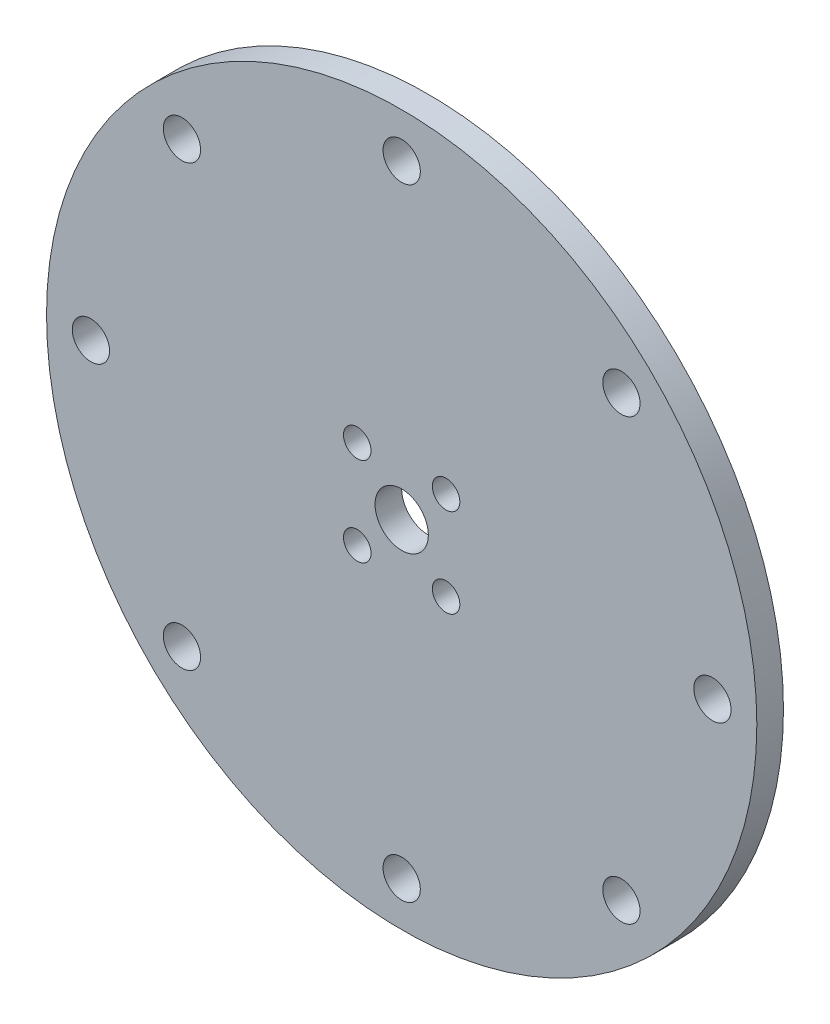
from build123d import *

# Parameters (mm, degrees)
SKETCH_3_R           = 48
EXTRUDE_2_DEPTH      = 3
SKETCH_4_R           = 3
CUT_EXTRUDE_1_DEPTH  = 3
EXTRUDE_3_DEPTH      = 35
SKETCH_6_R           = 3
SKETCH_6_R_2         = 1.5
CUT_EXTRUDE_2_DEPTH  = 35
SKETCH_7_R           = 1.55
CUT_EXTRUDE_5_DEPTH  = 35
CUT_EXTRUDE_START    = -35
SKETCH_9_R           = 48
SKETCH_9_R_2         = 40
CUT_EXTRUDE_6_DEPTH  = 35
SKETCH_10_R          = 40
CUT_EXTRUDE_7_DEPTH  = 35
SKETCH_11_W          = 111.588244868
SKETCH_11_H          = 82.223617215
CUT_EXTRUDE_8_DEPTH  = 35
SKETCH_12_R          = 1
CUT_EXTRUDE_9_DEPTH  = 35
SKETCH_13_R          = 2.1
CUT_EXTRUDE_10_DEPTH = 35
SKETCH_14_R          = 1.55
CUT_EXTRUDE_11_DEPTH = 35


with BuildPart() as part:
    # 草图3 → 凸台-拉伸2 (new body)
    with BuildSketch(Plane.XY):
        Circle(SKETCH_3_R)
    extrude(amount=EXTRUDE_2_DEPTH)

    # 草图4 → 切除-拉伸1 (cut)
    with BuildSketch(Plane.XY.offset(3)):
        Circle(SKETCH_4_R)
    extrude(amount=-CUT_EXTRUDE_1_DEPTH, mode=Mode.SUBTRACT)

    # 草图5 → 凸台-拉伸3 (add)
    with BuildSketch(Plane.XY.offset(3)):
        with BuildLine():
            ThreePointArc((0, 12.5), (0.146446609, 12.853553391), (0.5, 13))
            Line((0.5, 13), (39.5, 13))
            ThreePointArc((39.5, 13), (39.853553391, 12.853553391), (40, 12.5))
            Line((40, 12.5), (40, -12.5))
            ThreePointArc((40, -12.5), (39.853553391, -12.853553391), (39.5, -13))
            Line((39.5, -13), (0.5, -13))
            ThreePointArc((0.5, -13), (0.146446609, -12.853553391), (0, -12.5))
            Line((0, -12.5), (0, -11.5))
            ThreePointArc((0, -11.5), (0.146446609, -11.146446609), (0.5, -11))
            Line((0.5, -11), (37.5, -11))
            ThreePointArc((37.5, -11), (37.853553391, -10.853553391), (38, -10.5))
            Line((38, -10.5), (38, 0))
            Line((38, 0), (38, 10.5))
            ThreePointArc((38, 10.5), (37.853553391, 10.853553391), (37.5, 11))
            Line((37.5, 11), (0.5, 11))
            ThreePointArc((0.5, 11), (0.146446609, 11.146446609), (0, 11.5))
            Line((0, 11.5), (0, 12.5))
        make_face()
    extrude(amount=EXTRUDE_3_DEPTH)

    # 草图6 → 切除-拉伸2 (cut)
    with BuildSketch(Plane(origin=(40, 0, 0), x_dir=(0, 0, -1), z_dir=(1, 0, 0))):
        with Locations((-25, 0)):
            Circle(SKETCH_6_R)
        with Locations((-20, -5)):
            Circle(SKETCH_6_R_2)
        with Locations((-20, 5)):
            Circle(SKETCH_6_R_2)
        with Locations((-30, -5)):
            Circle(SKETCH_6_R_2)
        with Locations((-30, 5)):
            Circle(SKETCH_6_R_2)
    extrude(amount=-CUT_EXTRUDE_2_DEPTH, mode=Mode.SUBTRACT)

    # 草图7 → 切除-拉伸5 (cut)
    with BuildSketch(Plane.XY.offset(3)):
        with Locations((-35, 0)):
            Circle(SKETCH_7_R)
        with Locations((-24.748737342, 24.748737342)):
            Circle(SKETCH_7_R)
        with Locations((0, 35)):
            Circle(SKETCH_7_R)
        with Locations((24.748737342, 24.748737342)):
            Circle(SKETCH_7_R)
        with Locations((35, 0)):
            Circle(SKETCH_7_R)
        with Locations((24.748737342, -24.748737342)):
            Circle(SKETCH_7_R)
        with Locations((0, -35)):
            Circle(SKETCH_7_R)
        with Locations((-24.748737342, -24.748737342)):
            Circle(SKETCH_7_R)
    extrude(amount=-CUT_EXTRUDE_5_DEPTH, mode=Mode.SUBTRACT)

    # 草图9 → 切除-拉伸6 (cut)
    with BuildSketch(Plane.XY.offset(3).offset(CUT_EXTRUDE_START)):
        Circle(SKETCH_9_R)
        Circle(SKETCH_9_R_2, mode=Mode.SUBTRACT)
    extrude(amount=CUT_EXTRUDE_6_DEPTH, mode=Mode.SUBTRACT)

    # 草图10 → 切除-拉伸7 (cut)
    with BuildSketch(Plane.XY.offset(3)):
        Circle(SKETCH_10_R)
    extrude(amount=CUT_EXTRUDE_7_DEPTH, mode=Mode.SUBTRACT)


with BuildPart() as cut_extrude_7_piece_1:
    # of the separate pieces the step leaves, piece 1, a body of its own (cut_extrude_7_pieces)
    add(part.part.solids().sort_by_distance((40, 0, 0))[0])

    # 草图12 → 切除-拉伸9 (cut)
    with BuildSketch(Plane.XY.offset(3)):
        with BuildLine():
            ThreePointArc((-4, 5), (-5.707106781, 5.707106781), (-5, 4))
            Line((-5, 4), (-5, 5))
            Line((-5, 5), (-4, 5))
        make_face()
        with BuildLine():
            Line((-5, 5), (-5, 4))
            ThreePointArc((-5, 4), (-4.292893219, 4.292893219), (-4, 5))
            Line((-4, 5), (-5, 5))
        make_face()
        with Locations((-5, -5)):
            Circle(SKETCH_12_R)
        with Locations((5, -5)):
            Circle(SKETCH_12_R)
        with Locations((5, 5)):
            Circle(SKETCH_12_R)
    extrude(amount=-CUT_EXTRUDE_9_DEPTH, mode=Mode.SUBTRACT)

    # 草图13 → 切除-拉伸10 (cut)
    with BuildSketch(Plane.XY.offset(3)):
        with Locations((0, 35)):
            Circle(SKETCH_13_R)
        with Locations((24.748737342, 24.748737342)):
            Circle(SKETCH_13_R)
        with Locations((35, 0)):
            Circle(SKETCH_13_R)
        with Locations((24.748737342, -24.748737342)):
            Circle(SKETCH_13_R)
        with Locations((0, -35)):
            Circle(SKETCH_13_R)
        with Locations((-24.748737342, -24.748737342)):
            Circle(SKETCH_13_R)
        with Locations((-35, 0)):
            Circle(SKETCH_13_R)
        with Locations((-24.748737342, 24.748737342)):
            Circle(SKETCH_13_R)
    extrude(amount=-CUT_EXTRUDE_10_DEPTH, mode=Mode.SUBTRACT)

    # 草图14 → 切除-拉伸11 (cut)
    with BuildSketch(Plane.XY.offset(3)):
        with Locations((-5, 5)):
            Circle(SKETCH_14_R)
        with Locations((5, 5)):
            Circle(SKETCH_14_R)
        with Locations((5, -5)):
            Circle(SKETCH_14_R)
        with Locations((-5, -5)):
            Circle(SKETCH_14_R)
    extrude(amount=-CUT_EXTRUDE_11_DEPTH, mode=Mode.SUBTRACT)


with BuildPart() as cut_extrude_7_piece_2:
    # of the separate pieces the step leaves, piece 2, a body of its own (cut_extrude_7_pieces)
    add(part.part.solids().sort_by_distance((40, -12.5, 3))[0])


with BuildPart() as cut_extrude_7_piece_3:
    # of the separate pieces the step leaves, piece 3, a body of its own (cut_extrude_7_pieces)
    add(part.part.solids().sort_by_distance((39.5, 13, 3))[0])


with BuildPart() as cut_extrude_8_tool:
    # 草图11 → 切除-拉伸8 (new body)
    with BuildSketch(Plane(origin=(40, 0, 0), x_dir=(0, 0, -1), z_dir=(1, 0, 0))):
        with Locations((-58.794122434, 24.320721942)):
            Rectangle(SKETCH_11_W, SKETCH_11_H)
    extrude(amount=-CUT_EXTRUDE_8_DEPTH)


with BuildPart() as cut_extrude_7_piece_2_1:
    add(cut_extrude_7_piece_2.part)

    # 切除-拉伸8: cut by cut_extrude_8_tool
    add(cut_extrude_8_tool.part, mode=Mode.SUBTRACT)


with BuildPart() as cut_extrude_7_piece_3_1:
    add(cut_extrude_7_piece_3.part)

    # 切除-拉伸8: cut by cut_extrude_8_tool
    add(cut_extrude_8_tool.part, mode=Mode.SUBTRACT)


solid = cut_extrude_7_piece_1.part
